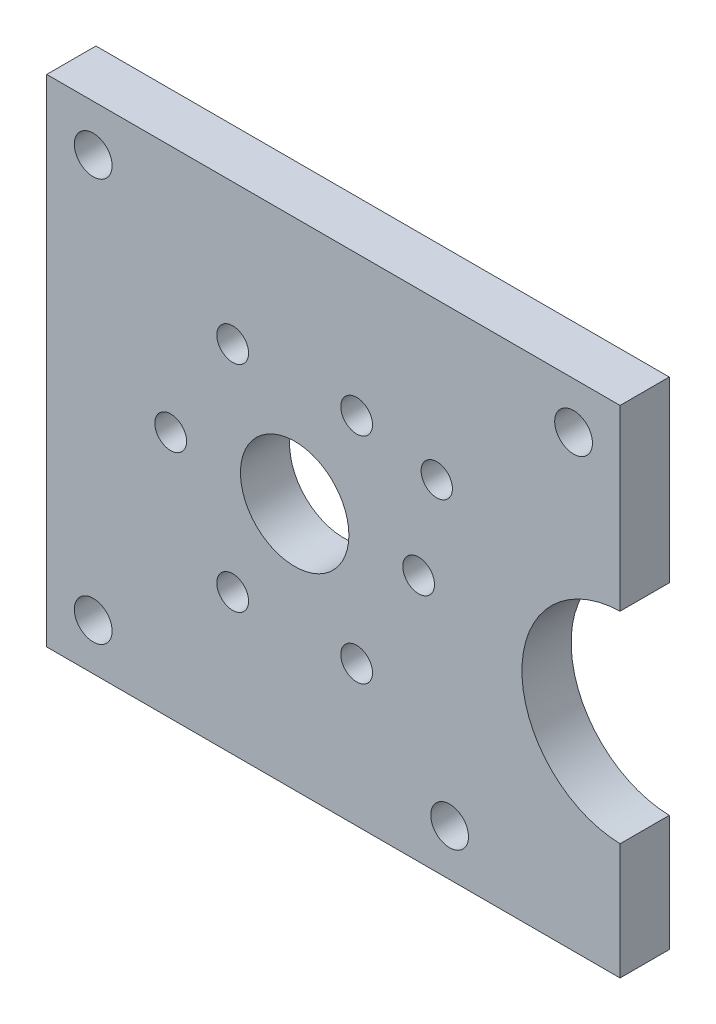
from build123d import *

# Parameters (mm, degrees)
SKETCH1_R                 = 1.01
SKETCH1_R_2               = 3.5
BOSS_EXTRUDE2_DEPTH       = 3.175
F_2_CLEARANCE_HOLE1_D     = 2.4384
F_2_CLEARANCE_HOLE1_DEPTH = 3.302
F_2_CLEARANCE_HOLE1_TIP   = 0.732569267
M2_5X0_45_TAPPED_HOLE1_D  = 2.05


with BuildPart() as part:
    # Sketch1 → Boss-Extrude2 (new body)
    with BuildSketch(Plane.XY):
        with BuildLine():
            Line((0, 0), (37, 0))
            Line((37, 0), (37, 7.50213794))
            ThreePointArc((37, 7.50213794), (30.666699296, 14), (37, 20.49786206))
            Line((37, 20.49786206), (37, 32))
            Line((37, 32), (0, 32))
            Line((0, 32), (0, 0))
        make_face()
        with Locations((25.169778966, 21.933400182)):
            Circle(SKETCH1_R, mode=Mode.SUBTRACT)
        with Locations((16, 16)):
            Circle(SKETCH1_R_2, mode=Mode.SUBTRACT)
    extrude(amount=BOSS_EXTRUDE2_DEPTH)

    # #2 Clearance Hole1
    with Locations(Plane.XY.offset(3.175)):
        with Locations((3, 29), (3, 3), (34, 29), (26, 3)):
            Hole(F_2_CLEARANCE_HOLE1_D / 2, depth=F_2_CLEARANCE_HOLE1_DEPTH)
            with Locations((0, 0, -(F_2_CLEARANCE_HOLE1_DEPTH + F_2_CLEARANCE_HOLE1_TIP / 2))):  # 118° drill point
                Cone(0, F_2_CLEARANCE_HOLE1_D / 2, F_2_CLEARANCE_HOLE1_TIP, mode=Mode.SUBTRACT)

    # M2.5x0.45 Tapped Hole1 (through all)
    with Locations(Plane.XY.offset(3.175)):
        with Locations((8, 16), (12, 22.92820323), (20, 22.92820323), (24, 16), (20, 9.07179677), (12, 9.07179677), (16, 16)):
            Hole(M2_5X0_45_TAPPED_HOLE1_D / 2)


solid = part.part
